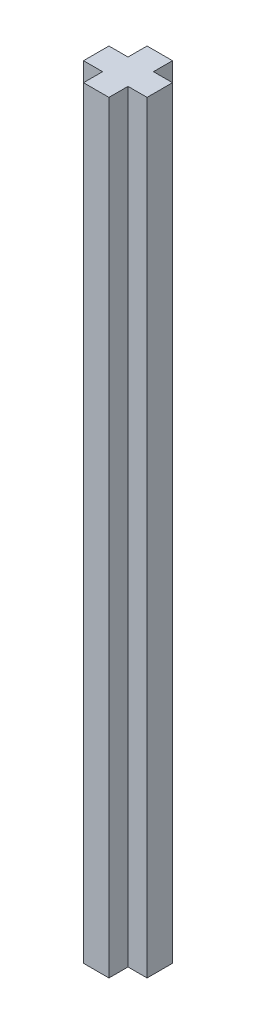
from build123d import *

# Parameters (mm, degrees)
EXTRUDE_1_DEPTH = 60


with BuildPart() as part:
    # 草图1 → 凸台-拉伸1 (new body)
    with BuildSketch(Plane(origin=(0, 0, 0), x_dir=(1, 0, 0), z_dir=(0, 1, 0))):
        Polygon((1, 1), (2.5, 1), (2.5, -1), (1, -1), (1, -2.5), (-1, -2.5), (-1, -1), (-2.5, -1), (-2.5, 1), (-1, 1), (-1, 2.5), (1, 2.5), align=None)
    extrude(amount=EXTRUDE_1_DEPTH)


solid = part.part
